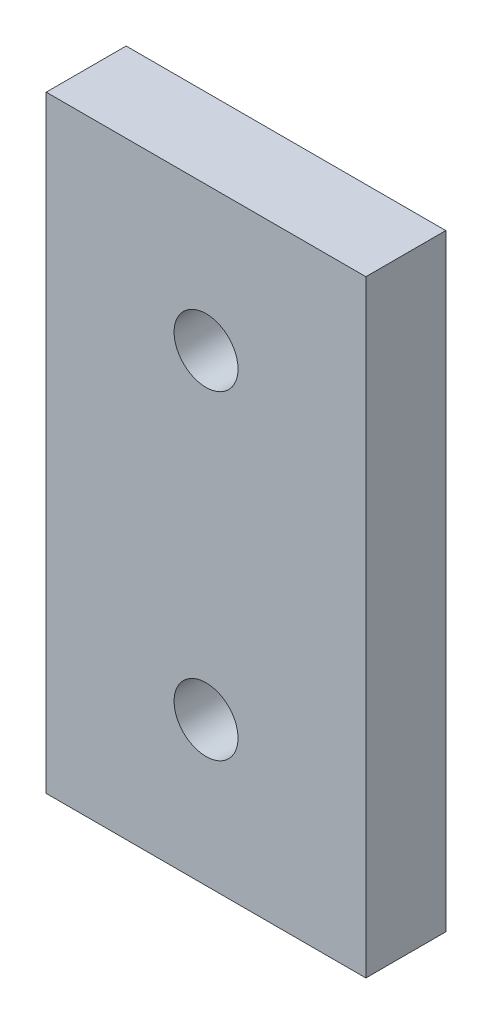
from build123d import *

# Parameters (mm, degrees)
SKETCH1_W           = 20
SKETCH1_H           = 38
SKETCH1_R           = 2
BOSS_EXTRUDE1_DEPTH = 5


with BuildPart() as part:
    # Sketch1 → Boss-Extrude1 (new body)
    with BuildSketch(Plane.XY):
        Rectangle(SKETCH1_W, SKETCH1_H)
        with Locations((0, 10)):
            Circle(SKETCH1_R, mode=Mode.SUBTRACT)
        with Locations((0, -10)):
            Circle(SKETCH1_R, mode=Mode.SUBTRACT)
    extrude(amount=BOSS_EXTRUDE1_DEPTH)


solid = part.part
